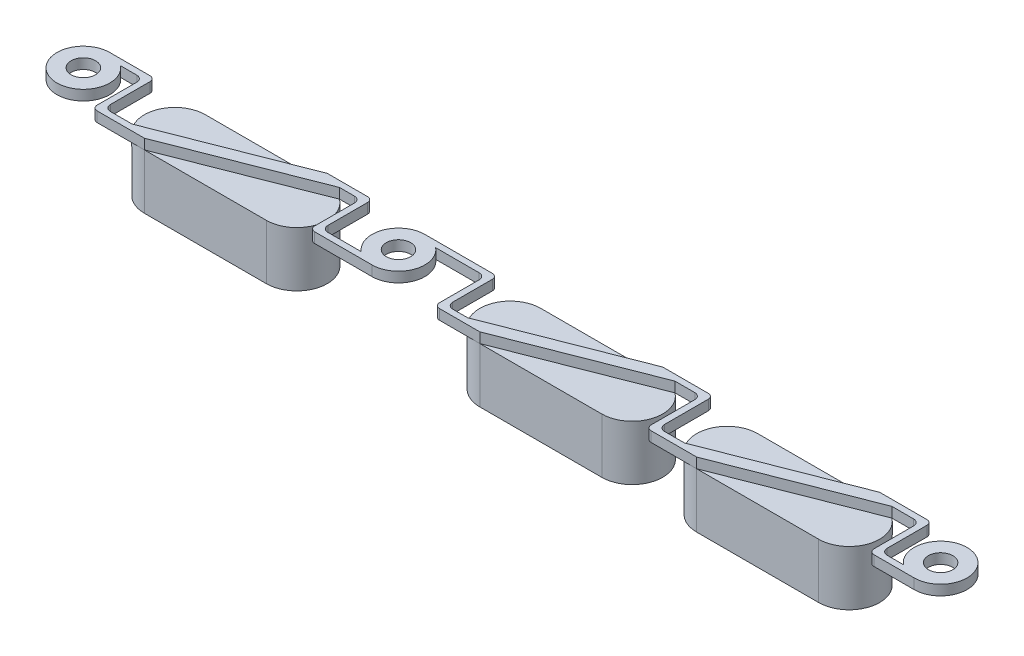
from build123d import *

# Parameters (mm, degrees)
EXTRUDE_1_DEPTH     = 2.7
EXTRUDE_1_2_DEPTH   = 2.7
EXTRUDE_1_3_DEPTH   = 2.7
EXTRUDE_2_DEPTH     = 0.5
CUT_EXTRUDE_1_REACH = 27.488
SKETCH_2_3_R        = 0.6


with BuildPart() as part:
    # 草图1 → 凸台-拉伸1 (new body)
    with BuildSketch(Plane(origin=(0, 0, 0), x_dir=(1, 0, 0), z_dir=(0, 1, 0))):
        with BuildLine():
            Line((3, 1.5), (-3, 1.5))
            ThreePointArc((-3, 1.5), (-4.5, 0), (-3, -1.5))
            Line((-3, -1.5), (3, -1.5))
            ThreePointArc((3, -1.5), (4.5, 0), (3, 1.5))
        make_face()
    extrude(amount=EXTRUDE_1_DEPTH)



with BuildPart() as body_2:
    # 草图1 → Extrude 1 2 (new body)
    with BuildSketch(Plane(origin=(0, 0, 0), x_dir=(1, 0, 0), z_dir=(0, 1, 0))):
        with BuildLine():
            Line((-13.5, 1.5), (-19.5, 1.5))
            ThreePointArc((-19.5, 1.5), (-21, 0), (-19.5, -1.5))
            Line((-19.5, -1.5), (-13.5, -1.5))
            ThreePointArc((-13.5, -1.5), (-12, 0), (-13.5, 1.5))
        make_face()
    extrude(amount=EXTRUDE_1_2_DEPTH)


with BuildPart() as body_3:
    # 草图1 → Extrude 1 3 (new body)
    with BuildSketch(Plane(origin=(0, 0, 0), x_dir=(1, 0, 0), z_dir=(0, 1, 0))):
        with BuildLine():
            Line((13.67, 1.5), (7.67, 1.5))
            ThreePointArc((7.67, 1.5), (6.17, 0), (7.67, -1.5))
            Line((7.67, -1.5), (13.67, -1.5))
            ThreePointArc((13.67, -1.5), (15.17, 0), (13.67, 1.5))
        make_face()
    extrude(amount=EXTRUDE_1_3_DEPTH)


with BuildPart() as part_1:
    add(part.part)

    add(body_2.part)  # 凸台-拉伸2 merges body 2

    add(body_3.part)  # 凸台-拉伸2 merges body 3
    # 草图2 → 凸台-拉伸2 (add)
    with BuildSketch(Plane(origin=(0, 2.7, 0), x_dir=(1, 0, 0), z_dir=(0, 1, 0))):
        with BuildLine():
            Line((-24, 1.3), (-22.02, 1.3))
            ThreePointArc((-22.02, 1.3), (-21.843223305, 1.226776695), (-21.77, 1.05))
            Line((-21.77, 1.05), (-21.77, -0.9))
            ThreePointArc((-21.77, -0.9), (-21.682132034, -1.112132034), (-21.47, -1.2))
            Line((-21.47, -1.2), (-20.4, -1.2))
            Line((-20.4, -1.2), (-13.5, 1.5))
            Line((-13.5, 1.5), (-11.52, 1.5))
            ThreePointArc((-11.52, 1.5), (-11.343223305, 1.426776695), (-11.27, 1.25))
            Line((-11.27, 1.25), (-11.27, -0.7))
            ThreePointArc((-11.27, -0.7), (-11.182132034, -0.912132034), (-10.97, -1))
            Line((-10.97, -1), (-9.330662386, -1))
            ThreePointArc((-9.330662386, -1), (-9.722701926, 0.441588043), (-8.5, 1.3))
            Line((-8.5, 1.3), (-5.18, 1.3))
            ThreePointArc((-5.18, 1.3), (-5.003223305, 1.226776695), (-4.93, 1.05))
            Line((-4.93, 1.05), (-4.93, -0.9))
            ThreePointArc((-4.93, -0.9), (-4.842132034, -1.112132034), (-4.63, -1.2))
            Line((-4.63, -1.2), (-3.9, -1.2))
            Line((-3.9, -1.2), (3, 1.5))
            Line((3, 1.5), (5.24, 1.5))
            ThreePointArc((5.24, 1.5), (5.416776695, 1.426776695), (5.49, 1.25))
            Line((5.49, 1.25), (5.49, -0.9))
            ThreePointArc((5.49, -0.9), (5.577867966, -1.112132034), (5.79, -1.2))
            Line((5.79, -1.2), (6.77, -1.2))
            Line((6.77, -1.2), (13.67, 1.5))
            Line((13.67, 1.5), (15.99, 1.5))
            ThreePointArc((15.99, 1.5), (16.166776695, 1.426776695), (16.24, 1.25))
            Line((16.24, 1.25), (16.24, -0.7))
            ThreePointArc((16.24, -0.7), (16.327867966, -0.912132034), (16.54, -1))
            Line((16.54, -1), (17.339337614, -1))
            ThreePointArc((17.339337614, -1), (18.611588043, 1.222701926), (18.17, -1.3))
            Line((18.17, -1.3), (16.19, -1.3))
            ThreePointArc((16.19, -1.3), (16.013223305, -1.226776695), (15.94, -1.05))
            Line((15.94, -1.05), (15.94, 0.9))
            ThreePointArc((15.94, 0.9), (15.852132034, 1.112132034), (15.64, 1.2))
            Line((15.64, 1.2), (14.57, 1.2))
            Line((14.57, 1.2), (7.67, -1.5))
            Line((7.67, -1.5), (5.43, -1.5))
            ThreePointArc((5.43, -1.5), (5.253223305, -1.426776695), (5.18, -1.25))
            Line((5.18, -1.25), (5.18, 0.9))
            ThreePointArc((5.18, 0.9), (5.092132034, 1.112132034), (4.88, 1.2))
            Line((4.88, 1.2), (3.9, 1.2))
            Line((3.9, 1.2), (-3, -1.5))
            Line((-3, -1.5), (-4.98, -1.5))
            ThreePointArc((-4.98, -1.5), (-5.156776695, -1.426776695), (-5.23, -1.25))
            Line((-5.23, -1.25), (-5.23, 0.7))
            ThreePointArc((-5.23, 0.7), (-5.317867966, 0.912132034), (-5.53, 1))
            Line((-5.53, 1), (-7.669337614, 1))
            ThreePointArc((-7.669337614, 1), (-7.277298074, -0.441588043), (-8.5, -1.3))
            Line((-8.5, -1.3), (-11.32, -1.3))
            ThreePointArc((-11.32, -1.3), (-11.496776695, -1.226776695), (-11.57, -1.05))
            Line((-11.57, -1.05), (-11.57, 0.9))
            ThreePointArc((-11.57, 0.9), (-11.657867966, 1.112132034), (-11.87, 1.2))
            Line((-11.87, 1.2), (-12.6, 1.2))
            Line((-12.6, 1.2), (-19.5, -1.5))
            Line((-19.5, -1.5), (-21.82, -1.5))
            ThreePointArc((-21.82, -1.5), (-21.996776695, -1.426776695), (-22.07, -1.25))
            Line((-22.07, -1.25), (-22.07, 0.7))
            ThreePointArc((-22.07, 0.7), (-22.157867966, 0.912132034), (-22.37, 1))
            Line((-22.37, 1), (-23.169337614, 1))
            ThreePointArc((-23.169337614, 1), (-24.441588043, -1.222701926), (-24, 1.3))
        make_face()
    extrude(amount=EXTRUDE_2_DEPTH)

    # 草图2<3> → 切除-拉伸1 (cut, up to next)
    with BuildSketch(Plane(origin=(0, 2.7, 0), x_dir=(1, 0, 0), z_dir=(0, 1, 0)), mode=Mode.PRIVATE) as cut_extrude_1_sk1:
        with Locations((-24, 0)):
            Circle(SKETCH_2_3_R)
    cut_extrude_1_tool1 = extrude(cut_extrude_1_sk1.sketch, amount=CUT_EXTRUDE_1_REACH, mode=Mode.PRIVATE) & part_1.part
    # 草图2<3> → 切除-拉伸1 (cut, up to next)
    with BuildSketch(Plane(origin=(0, 2.7, 0), x_dir=(1, 0, 0), z_dir=(0, 1, 0)), mode=Mode.PRIVATE) as cut_extrude_1_sk2:
        with Locations((-8.5, 0)):
            Circle(SKETCH_2_3_R)
    cut_extrude_1_tool2 = extrude(cut_extrude_1_sk2.sketch, amount=CUT_EXTRUDE_1_REACH, mode=Mode.PRIVATE) & part_1.part
    # 草图2<3> → 切除-拉伸1 (cut, up to next)
    with BuildSketch(Plane(origin=(0, 2.7, 0), x_dir=(1, 0, 0), z_dir=(0, 1, 0)), mode=Mode.PRIVATE) as cut_extrude_1_sk3:
        with Locations((18.17, 0)):
            Circle(SKETCH_2_3_R)
    cut_extrude_1_tool3 = extrude(cut_extrude_1_sk3.sketch, amount=CUT_EXTRUDE_1_REACH, mode=Mode.PRIVATE) & part_1.part
    add(cut_extrude_1_tool1.solids().sort_by_distance((-24, 2.7, 0))[0], mode=Mode.SUBTRACT)
    add(cut_extrude_1_tool2.solids().sort_by_distance((-8.5, 2.7, 0))[0], mode=Mode.SUBTRACT)
    add(cut_extrude_1_tool3.solids().sort_by_distance((18.17, 2.7, 0))[0], mode=Mode.SUBTRACT)


solid = part_1.part
